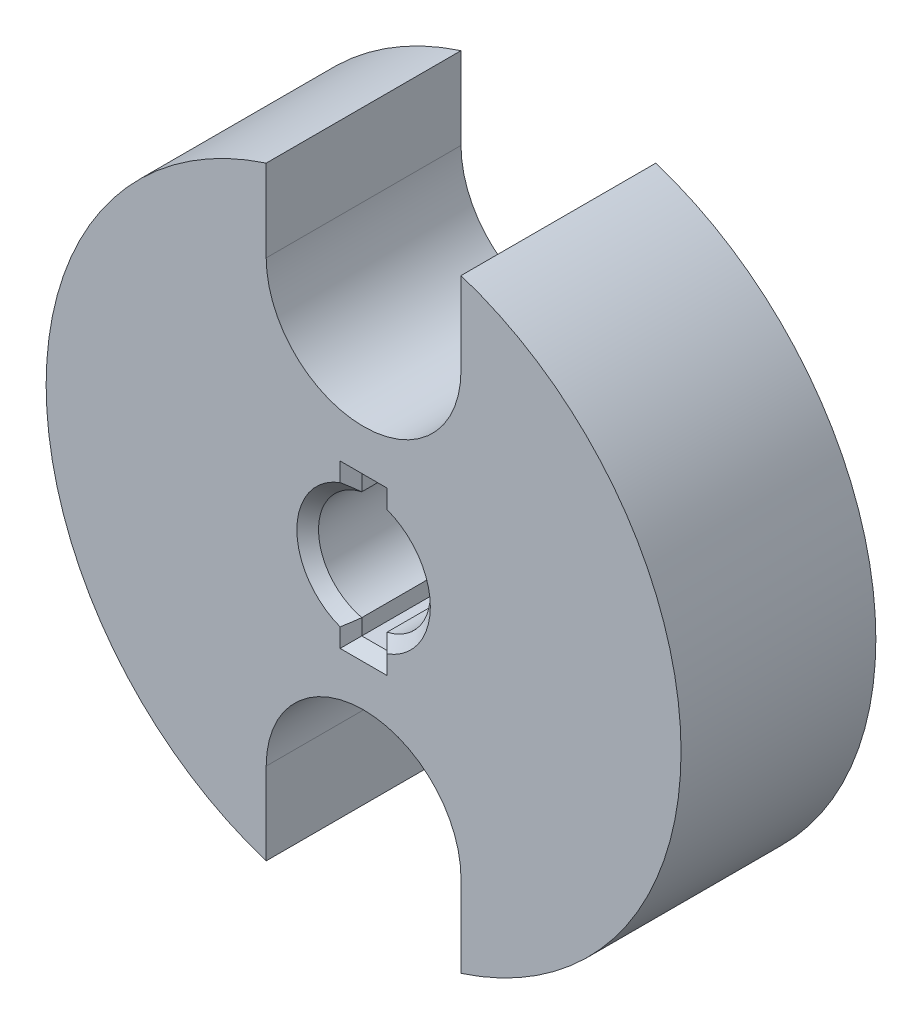
from build123d import *

# Parameters (mm, degrees)
BOSS_EXTRUDE1_DEPTH = 13.5
CHAMFER1_SIZE       = 0.75
CHAMFER2_SIZE       = 0.75
SCALE1_SCALE        = 0.9


with BuildPart() as part:
    # Sketch1 → Boss-Extrude1 (new body)
    # profile 1 of 3: a face of its own
    with BuildSketch(Plane.XY):
        with BuildLine():
            Line((-6.750000000000002, 15.249999999999998), (-6.750000000000003, 20.93889920697836))
            ThreePointArc((-6.750000000000044, 20.93889920697837), (-22, -1.685e-14), (-6.750000000000026, -20.938899206978377))
            Line((-6.749999999999997, -20.938899206978377), (-6.749999999999998, -15.25000000517543))
            Line((-6.749999999999998, -15.25000000517543), (-6.750000000000002, 15.249999999999998))
        make_face()
    # profile 2 of 3: a face of its own
    with BuildSketch(Plane.XY):
        with BuildLine():
            ThreePointArc((22, 0), (17.78341924377873, 12.95183384698863), (6.749999999999977, 20.93889920697839))
            Line((6.749999999999997, 20.938899206978398), (6.749999999999998, 15.25))
            Line((6.749999999999998, 15.25), (6.750000000000002, -15.25))
            Line((6.750000000000002, -15.25), (6.750000000000003, -20.93889920697839))
            ThreePointArc((6.749999999999982, -20.938899206978387), (17.78341924377873, -12.95183384698863), (22, -5.39e-15))
        make_face()
    # profile 3 of 3: a face of its own
    with BuildSketch(Plane.XY):
        with BuildLine():
            ThreePointArc((6.749999999999999, 15.249999999999998), (-1.24e-15, 8.5), (-6.749999999999999, 15.25))
            Line((-6.750000000000002, 15.249999999999998), (-6.749999999999998, -15.25000000517543))
            ThreePointArc((-6.75, -15.250000005175428), (-2.58771413e-09, -8.5), (6.75, -15.25))
            Line((6.750000000000002, -15.25), (6.749999999999998, 15.25))
        make_face()
        with BuildLine():
            Line((-0.8750000000000007, 3.7749172176354118), (-0.8750000000000008, 4.875))
            Line((-0.8750000000000008, 4.875), (0.8749999999999992, 4.875))
            Line((0.8749999999999992, 4.875), (0.8749999999999993, 3.774917217635379))
            ThreePointArc((0.8749999999999902, 3.774917217635377), (3.033665274877896, 2.4109126902482427), (3.875, 0))
            ThreePointArc((3.875, -9.5e-16), (3.033665274877896, -2.4109126902482427), (0.8749999999999918, -3.7749172176353767))
            Line((0.8750000000000004, -3.7749172176353767), (0.8750000000000006, -4.875))
            Line((0.8750000000000006, -4.875), (-0.8749999999999994, -4.875))
            Line((-0.8749999999999994, -4.875), (-0.8749999999999996, -3.774917217635412))
            ThreePointArc((-0.8749999999999161, -3.7749172176353945), (-3.875, 4.7e-16), (-0.8749999999999168, 3.774917217635394))
        make_face(mode=Mode.SUBTRACT)
    extrude(amount=BOSS_EXTRUDE1_DEPTH)

    # Chamfer1
    chamfer1_edges = [part.edges().sort_by_distance(p)[0] for p in [
        (-0.8749999999999996, -4.324958608817706, 0),
        (5.6e-16, -4.875, 0),
        (0.8750000000000004, -4.324958608817688, 0),
        (3.875, 1.22e-15, 0),
        (0.8749999999999993, 4.324958608817689, 0),
        (-7.8e-16, 4.875, 0),
        (-0.8750000000000007, 4.324958608817706, 0),
        (-3.8749999999999996, -3.3e-16, 0),
    ]]
    chamfer(chamfer1_edges, length=CHAMFER1_SIZE)

    # Chamfer2
    chamfer2_edges = [part.edges().sort_by_distance(p)[0] for p in [
        (-3.8749999999999996, -3.3e-16, 13.5),
        (-0.8750000000000007, 4.324958608817706, 13.5),
        (-7.8e-16, 4.875, 13.5),
        (0.8749999999999993, 4.324958608817689, 13.5),
        (3.875, -2.2e-16, 13.5),
        (0.8750000000000004, -4.324958608817688, 13.5),
        (5.6e-16, -4.875, 13.5),
        (-0.8749999999999996, -4.324958608817706, 13.5),
    ]]
    chamfer(chamfer2_edges, length=CHAMFER2_SIZE)


with BuildPart() as part_1:
    # Scale1: scaled about (0, 0, 6.75)
    add(part.part.scale(SCALE1_SCALE).moved(Location((0, 0, 0.6749999999999998))))


solid = part_1.part
